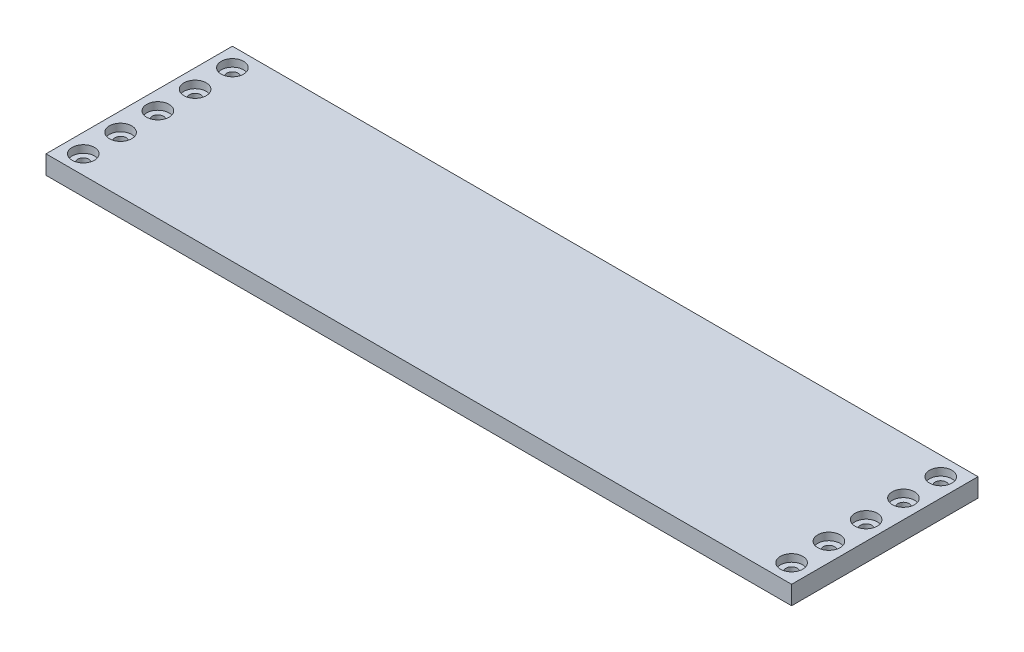
from build123d import *

# Parameters (mm, degrees)
SKETCH3_W           = 200
SKETCH3_H           = 50
BOSS_EXTRUDE1_DEPTH = 5
SKETCH4_R           = 1.5
CUT_EXTRUDE1_DEPTH  = 5
SKETCH5_R           = 3
SKETCH5_R_2         = 1.5
CUT_EXTRUDE2_DEPTH  = 2


with BuildPart() as part:
    # Sketch3 → Boss-Extrude1 (new body)
    with BuildSketch(Plane(origin=(0, 0, 0), x_dir=(1, 0, 0), z_dir=(0, 1, 0))):
        Rectangle(SKETCH3_W, SKETCH3_H)
    extrude(amount=BOSS_EXTRUDE1_DEPTH)

    # Sketch4 → Cut-Extrude1 (cut)
    with BuildSketch(Plane(origin=(0, 5, 0), x_dir=(1, 0, 0), z_dir=(0, 1, 0))):
        with Locations(Location((-95, 20, 0), (0, 0, 270))):
            Circle(SKETCH4_R)
        with Locations(Location((-95, 10, 0), (0, 0, 270))):
            Circle(SKETCH4_R)
        with Locations(Location((-95, 0, 0), (0, 0, 270))):
            Circle(SKETCH4_R)
        with Locations(Location((-95, -10, 0), (0, 0, 270))):
            Circle(SKETCH4_R)
        with Locations(Location((-95, -20, 0), (0, 0, 270))):
            Circle(SKETCH4_R)
        with Locations(Location((95, -20, 0), (0, 0, 90))):
            Circle(SKETCH4_R)
        with Locations(Location((95, -10, 0), (0, 0, 90))):
            Circle(SKETCH4_R)
        with Locations(Location((95, 0, 0), (0, 0, 90))):
            Circle(SKETCH4_R)
        with Locations(Location((95, 20, 0), (0, 0, 90))):
            Circle(SKETCH4_R)
        with Locations(Location((95, 10, 0), (0, 0, 90))):
            Circle(SKETCH4_R)
    extrude(amount=-CUT_EXTRUDE1_DEPTH, mode=Mode.SUBTRACT)

    # Sketch5 → Cut-Extrude2 (cut)
    # profile 1 of 10: a face of its own
    with BuildSketch(Plane(origin=(0, 5, 0), x_dir=(1, 0, 0), z_dir=(0, 1, 0))):
        with Locations(Location((-95, 20, 0), (0, 0, 270))):
            Circle(SKETCH5_R)
        with Locations(Location((-95, 20, 0), (0, 0, 270))):
            Circle(SKETCH5_R_2, mode=Mode.SUBTRACT)
    # profile 2 of 10: a face of its own
    with BuildSketch(Plane(origin=(0, 5, 0), x_dir=(1, 0, 0), z_dir=(0, 1, 0))):
        with Locations(Location((95, 20, 0), (0, 0, 270))):
            Circle(SKETCH5_R)
        with Locations(Location((95, 20, 0), (0, 0, 270))):
            Circle(SKETCH5_R_2, mode=Mode.SUBTRACT)
    # profile 3 of 10: a face of its own
    with BuildSketch(Plane(origin=(0, 5, 0), x_dir=(1, 0, 0), z_dir=(0, 1, 0))):
        with Locations(Location((-95, 10, 0), (0, 0, 270))):
            Circle(SKETCH5_R)
        with Locations(Location((-95, 10, 0), (0, 0, 270))):
            Circle(SKETCH5_R_2, mode=Mode.SUBTRACT)
    # profile 4 of 10: a face of its own
    with BuildSketch(Plane(origin=(0, 5, 0), x_dir=(1, 0, 0), z_dir=(0, 1, 0))):
        with Locations(Location((95, 10, 0), (0, 0, 270))):
            Circle(SKETCH5_R)
        with Locations(Location((95, 10, 0), (0, 0, 270))):
            Circle(SKETCH5_R_2, mode=Mode.SUBTRACT)
    # profile 5 of 10: a face of its own
    with BuildSketch(Plane(origin=(0, 5, 0), x_dir=(1, 0, 0), z_dir=(0, 1, 0))):
        with Locations(Location((-95, 0, 0), (0, 0, 270))):
            Circle(SKETCH5_R)
        with Locations(Location((-95, 0, 0), (0, 0, 270))):
            Circle(SKETCH5_R_2, mode=Mode.SUBTRACT)
    # profile 6 of 10: a face of its own
    with BuildSketch(Plane(origin=(0, 5, 0), x_dir=(1, 0, 0), z_dir=(0, 1, 0))):
        with Locations(Location((95, 0, 0), (0, 0, 270))):
            Circle(SKETCH5_R)
        with Locations(Location((95, 0, 0), (0, 0, 270))):
            Circle(SKETCH5_R_2, mode=Mode.SUBTRACT)
    # profile 7 of 10: a face of its own
    with BuildSketch(Plane(origin=(0, 5, 0), x_dir=(1, 0, 0), z_dir=(0, 1, 0))):
        with Locations(Location((-95, -10, 0), (0, 0, 270))):
            Circle(SKETCH5_R)
        with Locations(Location((-95, -10, 0), (0, 0, 270))):
            Circle(SKETCH5_R_2, mode=Mode.SUBTRACT)
    # profile 8 of 10: a face of its own
    with BuildSketch(Plane(origin=(0, 5, 0), x_dir=(1, 0, 0), z_dir=(0, 1, 0))):
        with Locations(Location((95, -10, 0), (0, 0, 270))):
            Circle(SKETCH5_R)
        with Locations(Location((95, -10, 0), (0, 0, 270))):
            Circle(SKETCH5_R_2, mode=Mode.SUBTRACT)
    # profile 9 of 10: a face of its own
    with BuildSketch(Plane(origin=(0, 5, 0), x_dir=(1, 0, 0), z_dir=(0, 1, 0))):
        with Locations(Location((-95, -20, 0), (0, 0, 270))):
            Circle(SKETCH5_R)
        with Locations(Location((-95, -20, 0), (0, 0, 270))):
            Circle(SKETCH5_R_2, mode=Mode.SUBTRACT)
    # profile 10 of 10: a face of its own
    with BuildSketch(Plane(origin=(0, 5, 0), x_dir=(1, 0, 0), z_dir=(0, 1, 0))):
        with Locations(Location((95, -20, 0), (0, 0, 270))):
            Circle(SKETCH5_R)
        with Locations(Location((95, -20, 0), (0, 0, 270))):
            Circle(SKETCH5_R_2, mode=Mode.SUBTRACT)
    extrude(amount=-CUT_EXTRUDE2_DEPTH, mode=Mode.SUBTRACT)


solid = part.part
